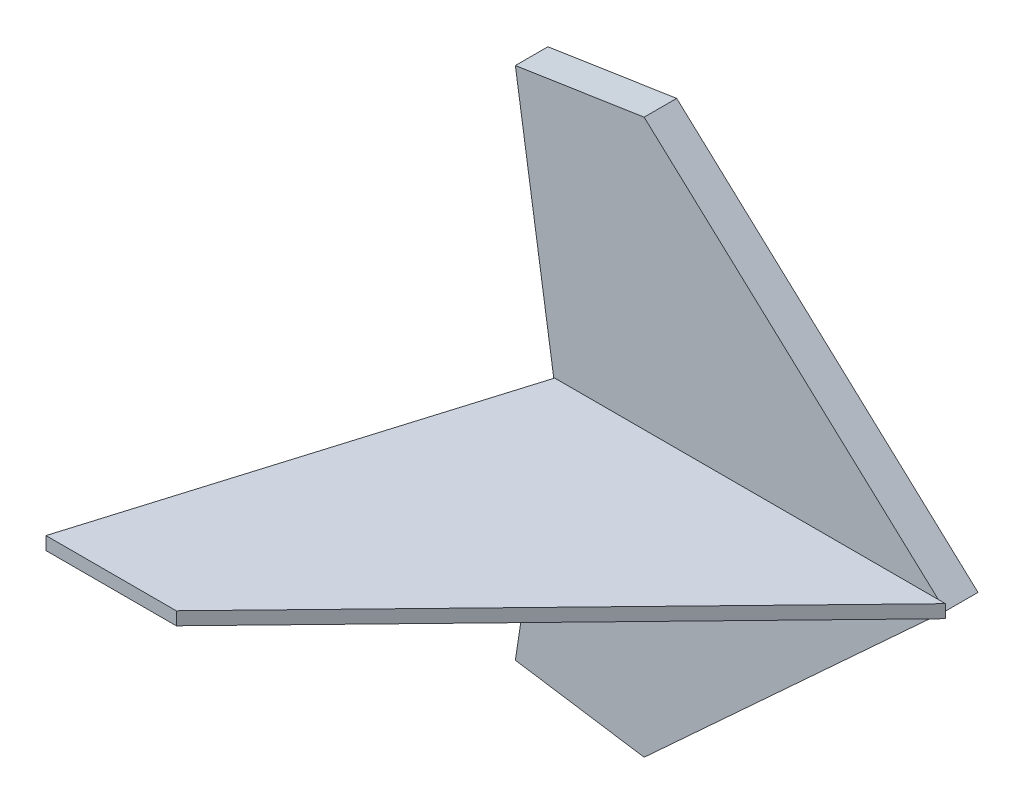
from build123d import *

# Parameters (mm, degrees)
BOSS_EXTRUDE1_DEPTH = 2.5
BOSS_EXTRUDE2_DEPTH = 0.5
SKETCH5_W           = 2
SKETCH5_H           = 2
BOSS_EXTRUDE3_DEPTH = 7.5


with BuildPart() as part:
    # Sketch3 → Boss-Extrude1 (new body)
    with BuildSketch(Plane.XY):
        Polygon((6.867406349, 21.280007755), (30, 0), (0, 0), (-3.018078023, 19.770968743), align=None)
        Polygon((-3.018078023, -19.770968743), (6.867406349, -21.280007755), (30, 0), (0, 0), align=None)
    extrude(amount=BOSS_EXTRUDE1_DEPTH)

    # Sketch5 → Boss-Extrude3 (add)
    with BuildSketch(Plane(origin=(0, 0, 0), x_dir=(-1, 0, 0), z_dir=(0, 0, -1))):
        with Locations((-10.9980603, -0.098027413)):
            Rectangle(SKETCH5_W, SKETCH5_H)
    extrude(amount=BOSS_EXTRUDE3_DEPTH)


with BuildPart() as body_2:
    # Sketch4 → Boss-Extrude2 (new, symmetric)
    with BuildSketch(Plane(origin=(0, 0, 0), x_dir=(1, 0, 0), z_dir=(0, 1, 0))):
        Polygon((-9.054234069, -32.5), (0, -2.5), (30, -2.5), (0.945765931, -32.5), align=None)
    extrude(amount=BOSS_EXTRUDE2_DEPTH, both=True)


solid = Compound([part.part, body_2.part])
